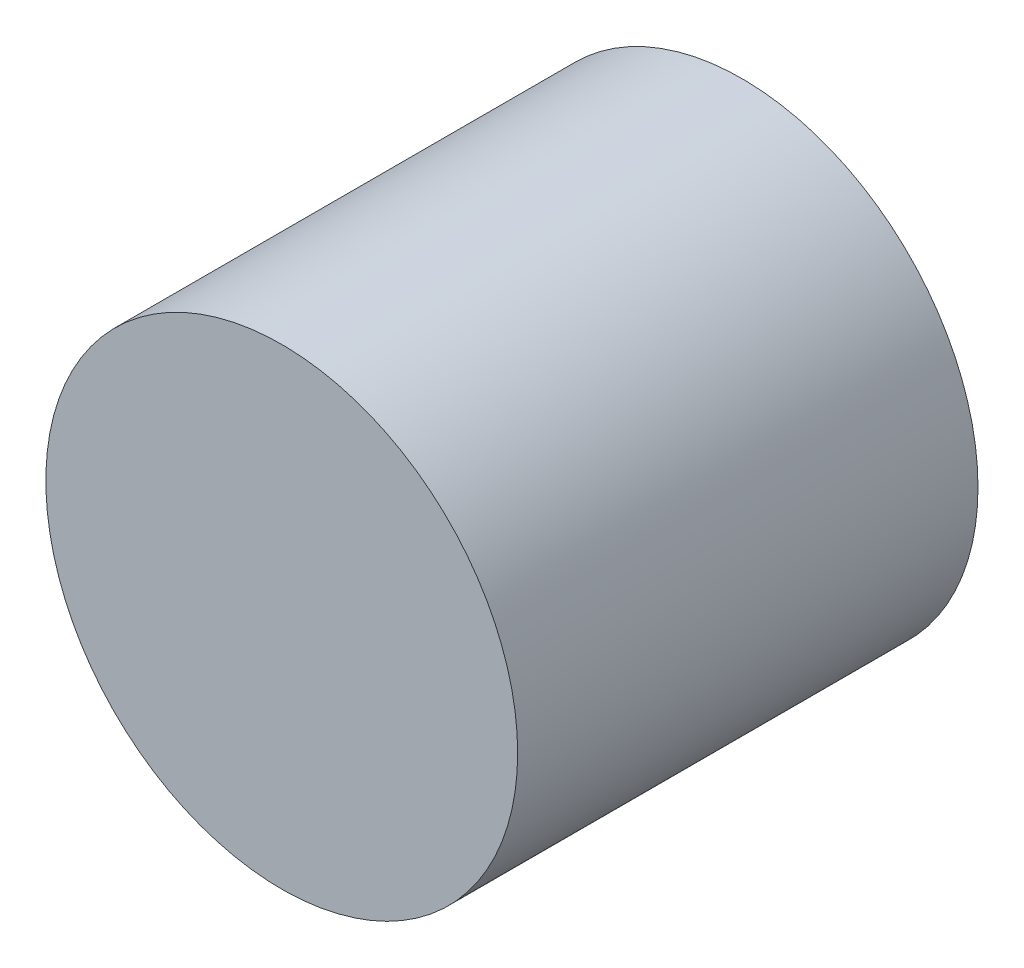
from build123d import *

# Parameters (mm, degrees)
SKETCH_1_W          = 85
SKETCH_1_H          = 16
EXTRUDE_1_DEPTH     = 8
SKETCH_2_R          = 11
EXTRUDE_2_DEPTH     = 8
SKETCH_3_R          = 11
EXTRUDE_3_DEPTH     = 8
SKETCH_4_OUTSIDE_W  = 130.906
SKETCH_4_OUTSIDE_H  = 45.906
SKETCH_4_OUTSIDE_R  = 4.1
CUT_EXTRUDE_1_DEPTH = 97.958754117


with BuildPart() as part:
    # 草图1 → 凸台-拉伸1 (new body)
    with BuildSketch(Plane.XY):
        with Locations((42.5, 0)):
            Rectangle(SKETCH_1_W, SKETCH_1_H)
    extrude(amount=EXTRUDE_1_DEPTH)

    # 草图2 → 凸台-拉伸2 (add)
    with BuildSketch(Plane.XY):
        Circle(SKETCH_2_R)
    extrude(amount=EXTRUDE_2_DEPTH)

    # 草图3 → 凸台-拉伸3 (add)
    with BuildSketch(Plane.XY):
        with Locations((85, 0)):
            Circle(SKETCH_3_R)
    extrude(amount=EXTRUDE_3_DEPTH)

    # 草图4 outside → 切除-拉伸1 (cut, through all)
    with BuildSketch(Plane.XY.offset(8)):
        with Locations((42.5, 0)):
            Rectangle(SKETCH_4_OUTSIDE_W, SKETCH_4_OUTSIDE_H)
        Circle(SKETCH_4_OUTSIDE_R, mode=Mode.SUBTRACT)
    extrude(amount=-CUT_EXTRUDE_1_DEPTH, mode=Mode.SUBTRACT)


solid = part.part
